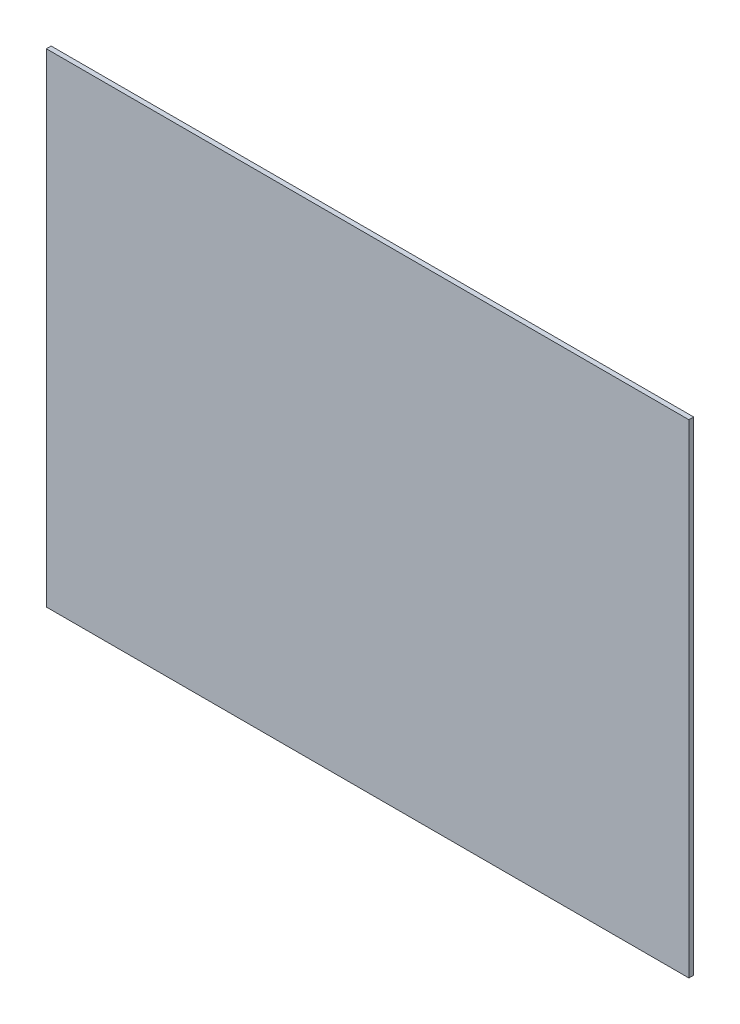
from build123d import *

# Parameters (mm, degrees)
SKETCH1_W           = 404
SKETCH1_H           = 304
BOSS_EXTRUDE1_DEPTH = 3


with BuildPart() as part:
    # Sketch1 → Boss-Extrude1 (new body)
    with BuildSketch(Plane.XY):
        Rectangle(SKETCH1_W, SKETCH1_H)
    extrude(amount=BOSS_EXTRUDE1_DEPTH)


solid = part.part
